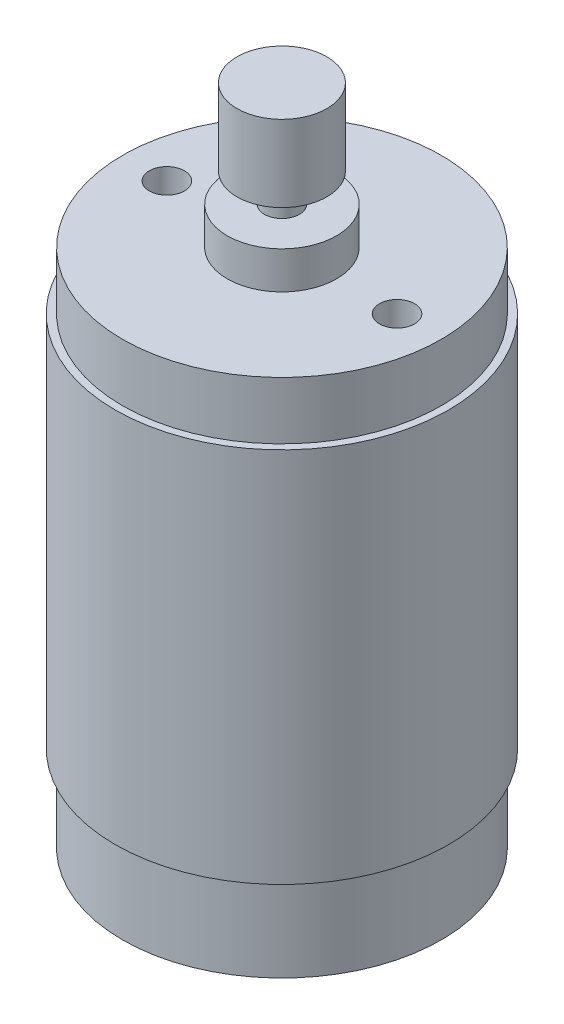
from build123d import *

# Parameters (mm, degrees)
SKETCH2_R          = 1.5875
CUT_EXTRUDE1_DEPTH = 6.35


with BuildPart() as part:
    # Sketch1 → Revolve1 (revolve)
    with BuildSketch(Plane(origin=(0, 0, 0), x_dir=(0, 0, -1), z_dir=(1, 0, 0)), mode=Mode.PRIVATE) as revolve1_sk:
        Polygon((0, 0), (0, 36.261189321), (0, 67.945), (4.064, 67.945), (4.064, 61.0235), (1.5875, 61.0235), (1.5875, 58.42), (4.94665, 58.42), (4.94665, 55.0418), (14.42085, 55.0418), (14.42085, 49.8348), (15.08125, 49.8348), (15.08125, 15.7734), (14.42085, 15.7734), (14.42085, 7.9756), (4.9911, 7.9756), (4.9911, 5.4102), (1.5748, 5.4102), (1.5748, 0), align=None)
    revolve(revolve1_sk.sketch.rotate(Axis((0, 67.945, 0), (0, -1, 0)), 180), axis=Axis((0, 67.945, 0), (0, -1, 0)))

    # Sketch2 → Cut-Extrude1 (cut)
    with BuildSketch(Plane(origin=(0, 55.0418, 0), x_dir=(1, 0, 0), z_dir=(0, 1, 0))):
        with Locations(Location((-10.414, 0, 0), (0, 0, 270))):
            Circle(SKETCH2_R)
        with Locations(Location((10.414, 0, 0), (0, 0, 90))):
            Circle(SKETCH2_R)
    extrude(amount=-CUT_EXTRUDE1_DEPTH, mode=Mode.SUBTRACT)


solid = part.part
